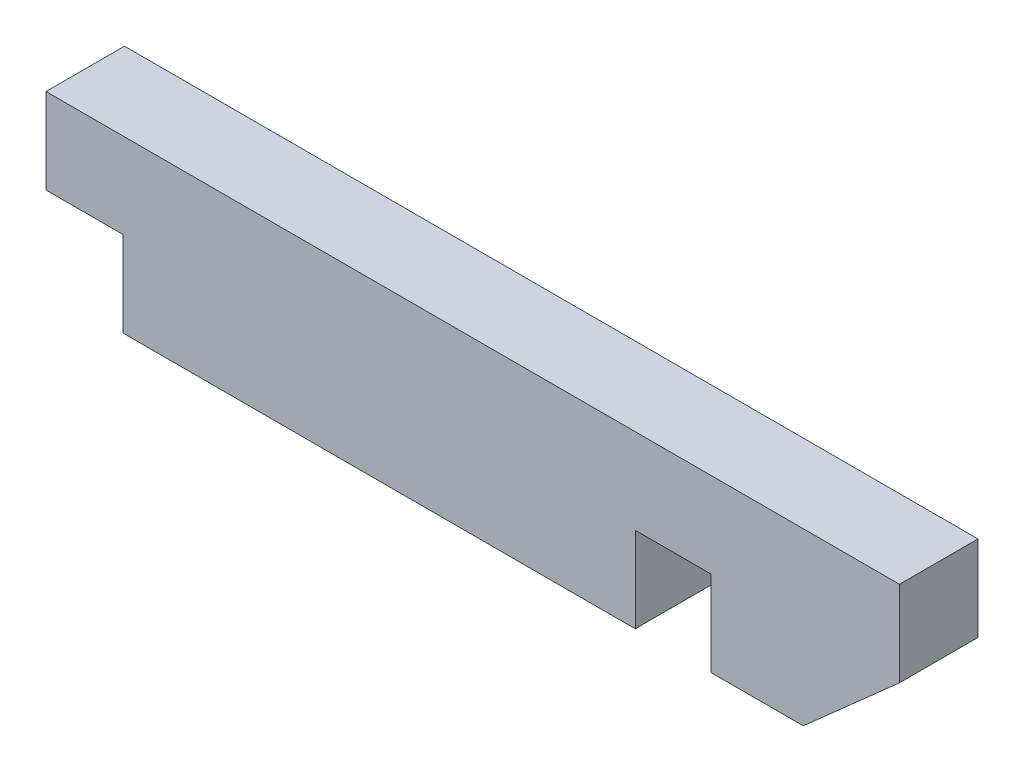
from build123d import *

# Parameters (mm, degrees)
BOSS_EXTRUDE1_DEPTH = 5.842


with BuildPart() as part:
    # Sketch1 → Boss-Extrude1 (new body)
    with BuildSketch(Plane.XY):
        Polygon((36.478045629, 0), (43.336045629, 0), (50.494045629, 6.35), (50.494045629, 12.7), (-13.005954371, 12.7), (-13.005954371, 6.35), (-7.263954371, 6.35), (-7.263954371, 0), (30.836045629, 0), (30.836045629, 6.35), (36.478045629, 6.35), align=None)
    extrude(amount=BOSS_EXTRUDE1_DEPTH)


solid = part.part
